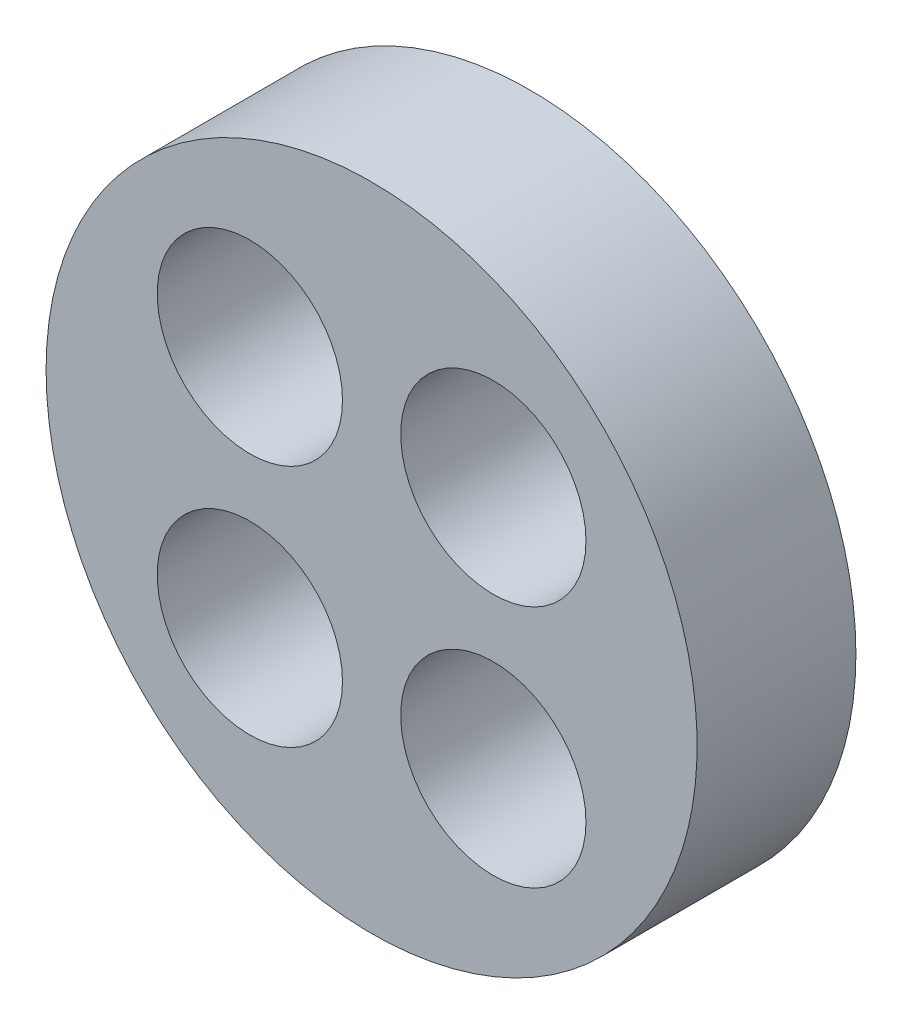
from build123d import *

# Parameters (mm, degrees)
SKETCH1_W                       = 12.7
SKETCH1_H                       = 1.5875
F_65_0_035_DIAMETER_HOLE1_D     = 0.889
F_65_0_035_DIAMETER_HOLE1_DEPTH = 9.525
F_65_0_035_DIAMETER_HOLE1_TIP   = 0.267082545
SKETCH5_W                       = 15.24
SKETCH5_H                       = 15.24
CUT_EXTRUDE1_DEPTH              = 3.81


with BuildPart() as part:
    # Sketch1 → Revolve1 (revolve)
    with BuildSketch(Plane(origin=(0, 0, 0), x_dir=(0, 0, -1), z_dir=(1, 0, 0))):
        with Locations((6.2484, 0.79375)):
            Rectangle(SKETCH1_W, SKETCH1_H)
    revolve(axis=Axis((0, 0, 0.1016), (0, 0, 1)))

    # Sketch2 → Cut-Revolve1 (revolve, cut)
    with BuildSketch(Plane(origin=(0, 0, 0), x_dir=(0, 0, -1), z_dir=(1, 0, 0)), mode=Mode.PRIVATE) as cut_revolve1_sk:
        Polygon((0, 0), (0, 1.5621), (4.4414817, 1.5621), (5.314787903, 2.435406202), (-1.432186341, 2.435406202), (-1.432186341, 0), align=None)
    revolve(cut_revolve1_sk.sketch.rotate(Axis((0, 0, 1.432186341), (0, 0, 1)), 90), axis=Axis((0, 0, 1.432186341), (0, 0, 1)), mode=Mode.SUBTRACT)

    # #65 (0.035) Diameter Hole1
    with Locations(Plane.XY):
        with Locations((0.5842, 0.5842), (-0.5842, 0.5842), (-0.5842, -0.5842), (0.5842, -0.5842)):
            Hole(F_65_0_035_DIAMETER_HOLE1_D / 2, depth=F_65_0_035_DIAMETER_HOLE1_DEPTH)
            with Locations((0, 0, -(F_65_0_035_DIAMETER_HOLE1_DEPTH + F_65_0_035_DIAMETER_HOLE1_TIP / 2))):  # 118° drill point
                Cone(0, F_65_0_035_DIAMETER_HOLE1_D / 2, F_65_0_035_DIAMETER_HOLE1_TIP, mode=Mode.SUBTRACT)

    # Sketch5 → Cut-Extrude1 (cut, symmetric)
    with BuildSketch(Plane(origin=(0, 0, 0), x_dir=(0, 0, -1), z_dir=(1, 0, 0))):
        with Locations((8.382, 0)):
            Rectangle(SKETCH5_W, SKETCH5_H)
    extrude(amount=CUT_EXTRUDE1_DEPTH, both=True, mode=Mode.SUBTRACT)


solid = part.part
